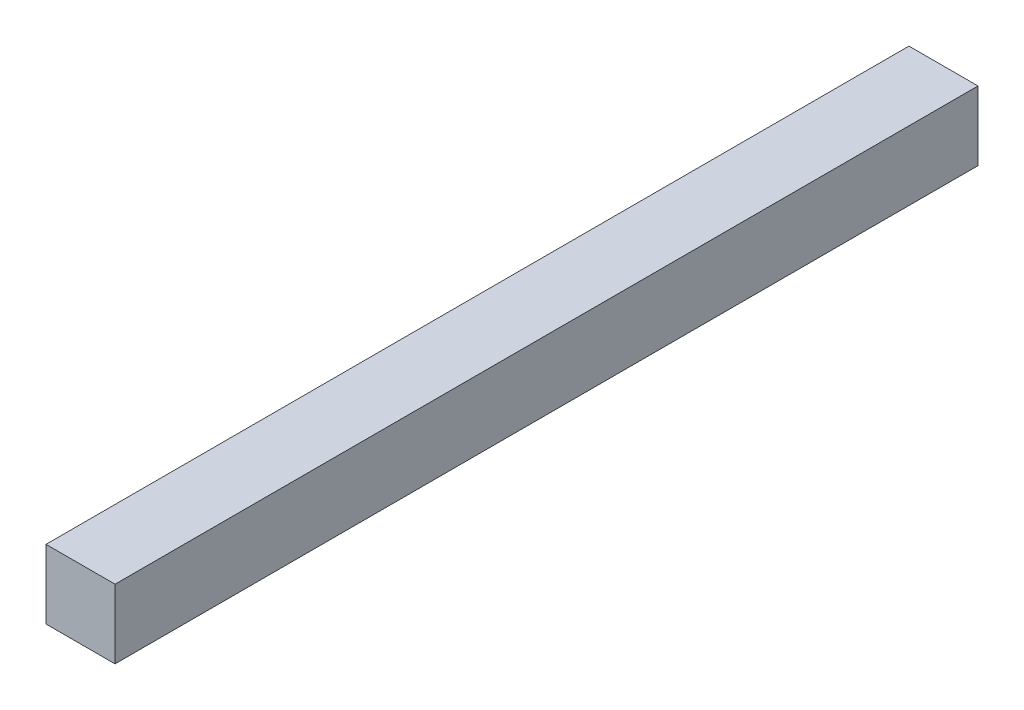
from build123d import *

# Parameters (mm, degrees)
SKETCH1_W           = 16
SKETCH1_H           = 16
BOSS_EXTRUDE1_DEPTH = 200


with BuildPart() as part:
    # Sketch1 → Boss-Extrude1 (new body)
    with BuildSketch(Plane.XY):
        Rectangle(SKETCH1_W, SKETCH1_H)
    extrude(amount=BOSS_EXTRUDE1_DEPTH)


solid = part.part
